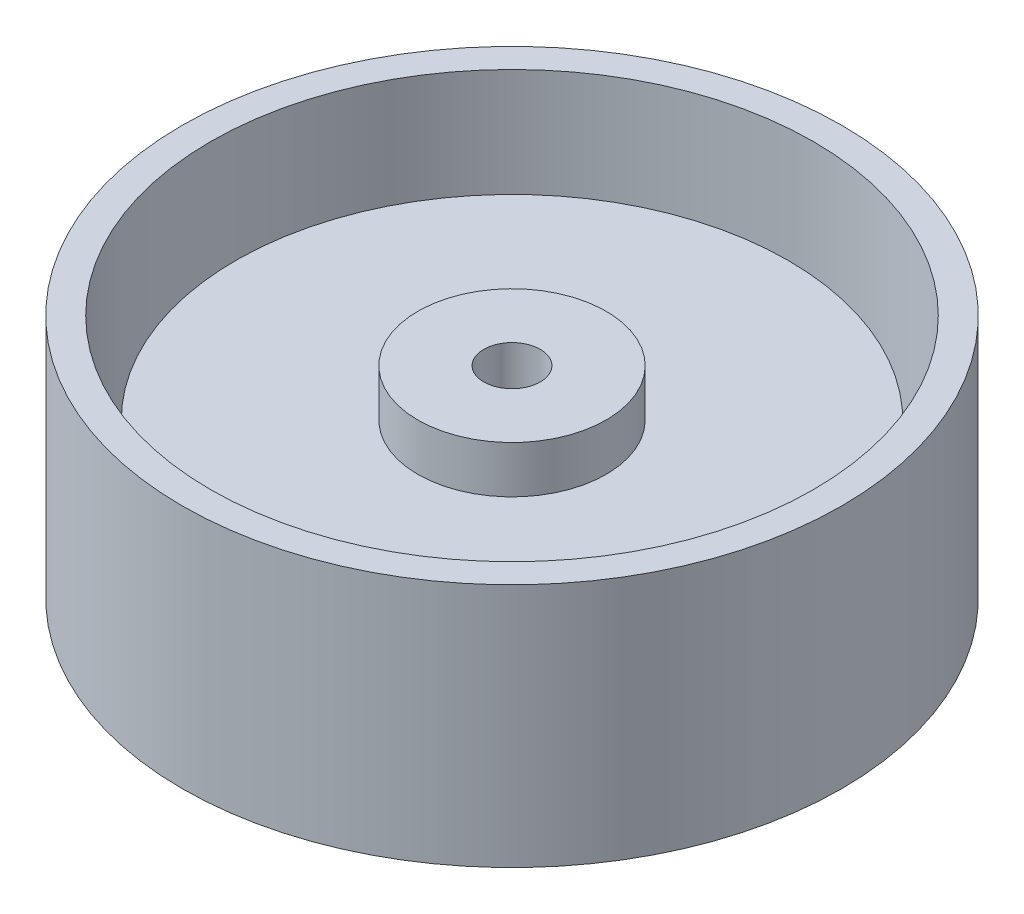
from build123d import *

# Parameters (mm, degrees)
VOLUME_KNOB_R                      = 35
KNOB_TOP_DEPTH                     = 3.5
VOLUME_KNOB_3_R                    = 35
VOLUME_KNOB_3_R_2                  = 32
KNOB_WALLS_DEPTH                   = 26
KNOB_START                         = 3.5
KNOB_SHAFT_KEYWAY_DEPTH            = 10
VOLUME_KNOB_8_R                    = 29.33
VOLUME_KNOB_8_R_2                  = 3
KNOB_DAMEPNING_EXTENSION_TOP_DEPTH = 12.9
KNOB_START_2                       = 16.4
VOLUME_KNOB_11_R                   = 10
VOLUME_KNOB_11_R_2                 = 3
KNOB_SHAFT_SUPPORT_DEPTH           = 5


with BuildPart() as part:
    # Volume Knob → Knob Top (new body)
    with BuildSketch(Plane(origin=(0, 0, 0), x_dir=(1, 0, 0), z_dir=(0, 1, 0))):
        with Locations(Location((0, 0, 0), (0, 0, 270))):
            Circle(VOLUME_KNOB_R)
    extrude(amount=KNOB_TOP_DEPTH)

    # Volume Knob<3> → Knob Walls (add)
    with BuildSketch(Plane(origin=(0, 0, 0), x_dir=(1, 0, 0), z_dir=(0, 1, 0))):
        with Locations(Location((0, 0, 0), (0, 0, 270))):
            Circle(VOLUME_KNOB_3_R)
        with Locations(Location((0, 0, 0), (0, 0, 90))):
            Circle(VOLUME_KNOB_3_R_2, mode=Mode.SUBTRACT)
    extrude(amount=KNOB_WALLS_DEPTH)

    # Volume Knob<4> → Knob Shaft Keyway (add)
    with BuildSketch(Plane(origin=(0, 0, 0), x_dir=(1, 0, 0), z_dir=(0, 1, 0)).offset(KNOB_START)):
        with BuildLine():
            Line((-2.598076211, 1.5), (2.598076211, 1.5))
            ThreePointArc((2.598076211, 1.5), (0, 3), (-2.598076211, 1.5))
        make_face()
    extrude(amount=KNOB_SHAFT_KEYWAY_DEPTH)

    # Volume Knob<8> → Knob Damepning Extension (top) (add)
    with BuildSketch(Plane(origin=(0, 0, 0), x_dir=(1, 0, 0), z_dir=(0, 1, 0)).offset(KNOB_START)):
        with Locations(Location((0, 0, 0), (0, 0, 90))):
            Circle(VOLUME_KNOB_8_R)
        with Locations(Location((0, 0, 0), (0, 0, 150))):
            Circle(VOLUME_KNOB_8_R_2, mode=Mode.SUBTRACT)
    extrude(amount=KNOB_DAMEPNING_EXTENSION_TOP_DEPTH)

    # Volume Knob<11> → Knob Shaft Support (add)
    with BuildSketch(Plane(origin=(0, 0, 0), x_dir=(1, 0, 0), z_dir=(0, 1, 0)).offset(KNOB_START_2)):
        with Locations(Location((0, 0, 0), (0, 0, 270))):
            Circle(VOLUME_KNOB_11_R)
        with Locations(Location((0, 0, 0), (0, 0, 150))):
            Circle(VOLUME_KNOB_11_R_2, mode=Mode.SUBTRACT)
    extrude(amount=KNOB_SHAFT_SUPPORT_DEPTH)


solid = part.part
